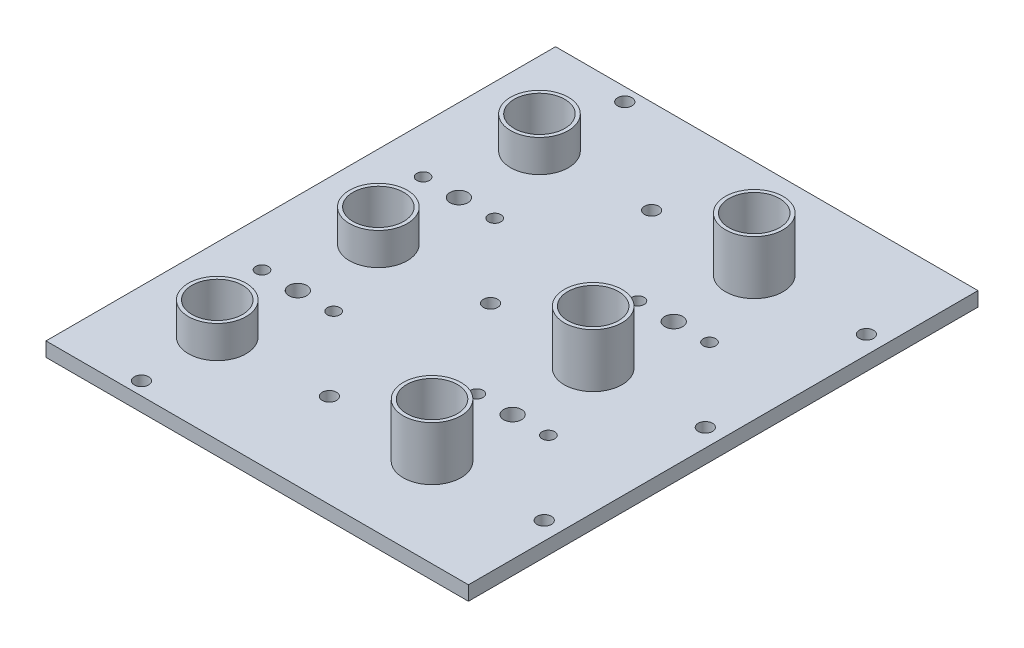
from build123d import *

# Parameters (mm, degrees)
SKETCH1_W           = 118
SKETCH1_H           = 142.339686002
SKETCH1_R           = 2
BOSS_EXTRUDE1_DEPTH = 4
SKETCH2_R           = 8.071067812
SKETCH2_R_2         = 7.071067812
BOSS_EXTRUDE2_DEPTH = 9
SKETCH2_4_R         = 8.071067812
SKETCH2_4_R_2       = 7.071067812
BOSS_EXTRUDE3_DEPTH = 15
CUT_EXTRUDE1_START  = -52
SKETCH2_5_R         = 7.071067812
CUT_EXTRUDE1_DEPTH  = 52
SKETCH4_R           = 1.75
SKETCH4_R_2         = 2.5
CUT_EXTRUDE2_DEPTH  = 52


with BuildPart() as part:
    # Sketch1 → Boss-Extrude1 (new body)
    with BuildSketch(Plane(origin=(0, 0, 0), x_dir=(1, 0, 0), z_dir=(0, 1, 0))):
        with Locations((6, 0)):
            Rectangle(SKETCH1_W, SKETCH1_H)
        with Locations((0, 45)):
            Circle(SKETCH1_R, mode=Mode.SUBTRACT)
        with Locations((60, 45)):
            Circle(SKETCH1_R, mode=Mode.SUBTRACT)
        Circle(SKETCH1_R, mode=Mode.SUBTRACT)
        with Locations((60, 0)):
            Circle(SKETCH1_R, mode=Mode.SUBTRACT)
        with Locations((0, -45)):
            Circle(SKETCH1_R, mode=Mode.SUBTRACT)
        with Locations((60, -45)):
            Circle(SKETCH1_R, mode=Mode.SUBTRACT)
        with Locations((-30, 67.5)):
            Circle(SKETCH1_R, mode=Mode.SUBTRACT)
        with Locations((-30, -67.5)):
            Circle(SKETCH1_R, mode=Mode.SUBTRACT)
    extrude(amount=BOSS_EXTRUDE1_DEPTH)

    # Sketch2 → Boss-Extrude2 (add)
    # profile 1 of 3: a face of its own
    with BuildSketch(Plane(origin=(0, 4, 0), x_dir=(1, 0, 0), z_dir=(0, 1, 0))):
        with Locations((-30, 43.669843001)):
            Circle(SKETCH2_R)
        with Locations((-30, 43.669843001)):
            Circle(SKETCH2_R_2, mode=Mode.SUBTRACT)
    # profile 2 of 3: a face of its own
    with BuildSketch(Plane(origin=(0, 4, 0), x_dir=(1, 0, 0), z_dir=(0, 1, 0))):
        with Locations((-30, -1.330156999)):
            Circle(SKETCH2_R)
        with Locations((-30, -1.330156999)):
            Circle(SKETCH2_R_2, mode=Mode.SUBTRACT)
    # profile 3 of 3: a face of its own
    with BuildSketch(Plane(origin=(0, 4, 0), x_dir=(1, 0, 0), z_dir=(0, 1, 0))):
        with Locations((-30, -46.330156999)):
            Circle(SKETCH2_R)
        with Locations((-30, -46.330156999)):
            Circle(SKETCH2_R_2, mode=Mode.SUBTRACT)
    extrude(amount=BOSS_EXTRUDE2_DEPTH)

    # Sketch2<4> → Boss-Extrude3 (add)
    # profile 1 of 3: a face of its own
    with BuildSketch(Plane(origin=(0, 4, 0), x_dir=(1, 0, 0), z_dir=(0, 1, 0))):
        with Locations((30, 43.669843001)):
            Circle(SKETCH2_4_R)
        with Locations((30, 43.669843001)):
            Circle(SKETCH2_4_R_2, mode=Mode.SUBTRACT)
    # profile 2 of 3: a face of its own
    with BuildSketch(Plane(origin=(0, 4, 0), x_dir=(1, 0, 0), z_dir=(0, 1, 0))):
        with Locations((30, -1.330156999)):
            Circle(SKETCH2_4_R)
        with Locations((30, -1.330156999)):
            Circle(SKETCH2_4_R_2, mode=Mode.SUBTRACT)
    # profile 3 of 3: a face of its own
    with BuildSketch(Plane(origin=(0, 4, 0), x_dir=(1, 0, 0), z_dir=(0, 1, 0))):
        with Locations((30, -46.330156999)):
            Circle(SKETCH2_4_R)
        with Locations((30, -46.330156999)):
            Circle(SKETCH2_4_R_2, mode=Mode.SUBTRACT)
    extrude(amount=BOSS_EXTRUDE3_DEPTH)

    # Sketch2<5> → Cut-Extrude1 (cut)
    with BuildSketch(Plane(origin=(0, 4, 0), x_dir=(1, 0, 0), z_dir=(0, 1, 0)).offset(CUT_EXTRUDE1_START)):
        with Locations((-30, 43.669843001)):
            Circle(SKETCH2_5_R)
        with Locations((-30, -1.330156999)):
            Circle(SKETCH2_5_R)
        with Locations((-30, -46.330156999)):
            Circle(SKETCH2_5_R)
        with Locations((30, 43.669843001)):
            Circle(SKETCH2_5_R)
        with Locations((30, -1.330156999)):
            Circle(SKETCH2_5_R)
        with Locations((30, -46.330156999)):
            Circle(SKETCH2_5_R)
    extrude(amount=CUT_EXTRUDE1_DEPTH, mode=Mode.SUBTRACT)

    # Sketch4 → Cut-Extrude2 (cut)
    with BuildSketch(Plane.XZ):
        with Locations((40, -21.169843001)):
            Circle(SKETCH4_R)
        with Locations((20, -21.169843001)):
            Circle(SKETCH4_R)
        with Locations((30, -21.169843001)):
            Circle(SKETCH4_R_2)
        with Locations((-40, -21.169843001)):
            Circle(SKETCH4_R)
        with Locations((-30, -21.169843001)):
            Circle(SKETCH4_R_2)
        with Locations((-20, -21.169843001)):
            Circle(SKETCH4_R)
        with Locations((-40, 23.830156999)):
            Circle(SKETCH4_R)
        with Locations((-30, 23.830156999)):
            Circle(SKETCH4_R_2)
        with Locations((-20, 23.830156999)):
            Circle(SKETCH4_R)
        with Locations((20, 23.830156999)):
            Circle(SKETCH4_R)
        with Locations((30, 23.830156999)):
            Circle(SKETCH4_R_2)
        with Locations((40, 23.830156999)):
            Circle(SKETCH4_R)
    extrude(amount=-CUT_EXTRUDE2_DEPTH, mode=Mode.SUBTRACT)


solid = part.part
